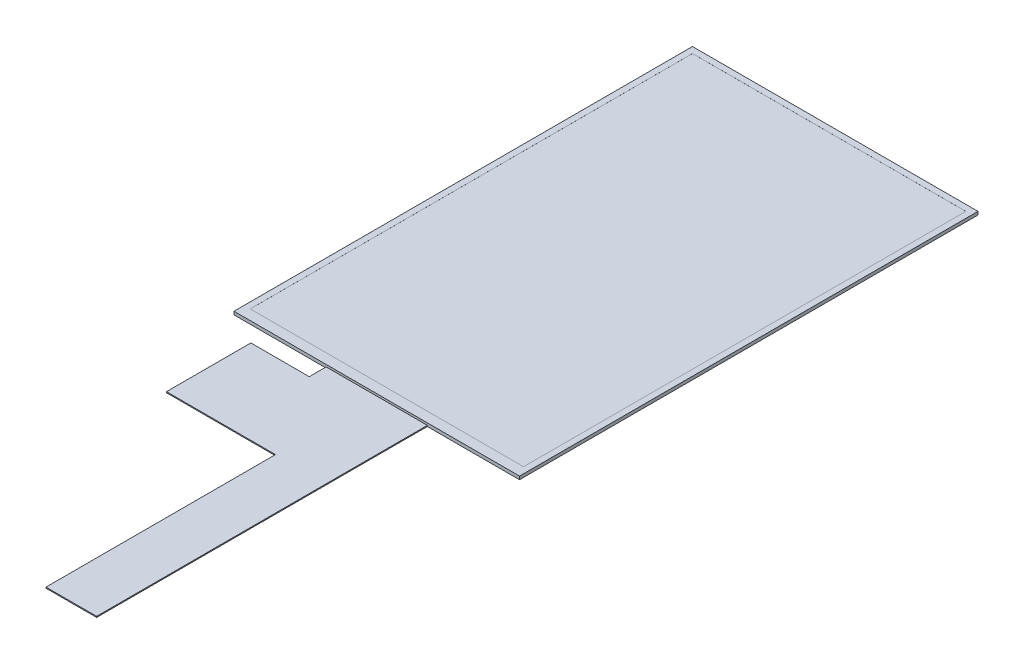
from build123d import *

# Parameters (mm, degrees)
SKETCH1_W           = 84.6
SKETCH1_H           = 135.85
BOSS_EXTRUDE1_DEPTH = 0.946
BOSS_EXTRUDE2_START = 0.01
BOSS_EXTRUDE2_DEPTH = 0.3
SKETCH3_W           = 81
SKETCH3_H           = 131.05
CUT_EXTRUDE1_DEPTH  = 0.01
CUT_EXTRUDE3_START  = -0.946
SKETCH3_2_W         = 81
SKETCH3_2_H         = 131.05
CUT_EXTRUDE3_DEPTH  = 0.01


with BuildPart() as part:
    # Sketch1 → Boss-Extrude1 (new body)
    with BuildSketch(Plane(origin=(0, 0, 0), x_dir=(1, 0, 0), z_dir=(0, 1, 0))):
        with Locations((0, 67.925)):
            Rectangle(SKETCH1_W, SKETCH1_H)
    extrude(amount=BOSS_EXTRUDE1_DEPTH)

    # Sketch2 → Boss-Extrude2 (add)
    with BuildSketch(Plane(origin=(0, 0, 0), x_dir=(1, 0, 0), z_dir=(0, 1, 0)).offset(BOSS_EXTRUDE2_START)):
        Polygon((-15, 0), (-15, -5), (-32.3, -5), (-32.3, -30), (0, -30), (0, -98), (15, -98), (15, 0), align=None)
    extrude(amount=BOSS_EXTRUDE2_DEPTH)

    # Sketch3 → Cut-Extrude1 (cut)
    with BuildSketch(Plane(origin=(0, 0.946, 0), x_dir=(1, 0, 0), z_dir=(0, 1, 0))):
        with Locations((0, 68.525)):
            Rectangle(SKETCH3_W, SKETCH3_H)
    extrude(amount=-CUT_EXTRUDE1_DEPTH, mode=Mode.SUBTRACT)

    # Sketch3<2> → Cut-Extrude3 (cut)
    with BuildSketch(Plane(origin=(0, 0.946, 0), x_dir=(1, 0, 0), z_dir=(0, 1, 0)).offset(CUT_EXTRUDE3_START)):
        with Locations((0, 68.525)):
            Rectangle(SKETCH3_2_W, SKETCH3_2_H)
    extrude(amount=CUT_EXTRUDE3_DEPTH, mode=Mode.SUBTRACT)


solid = part.part
